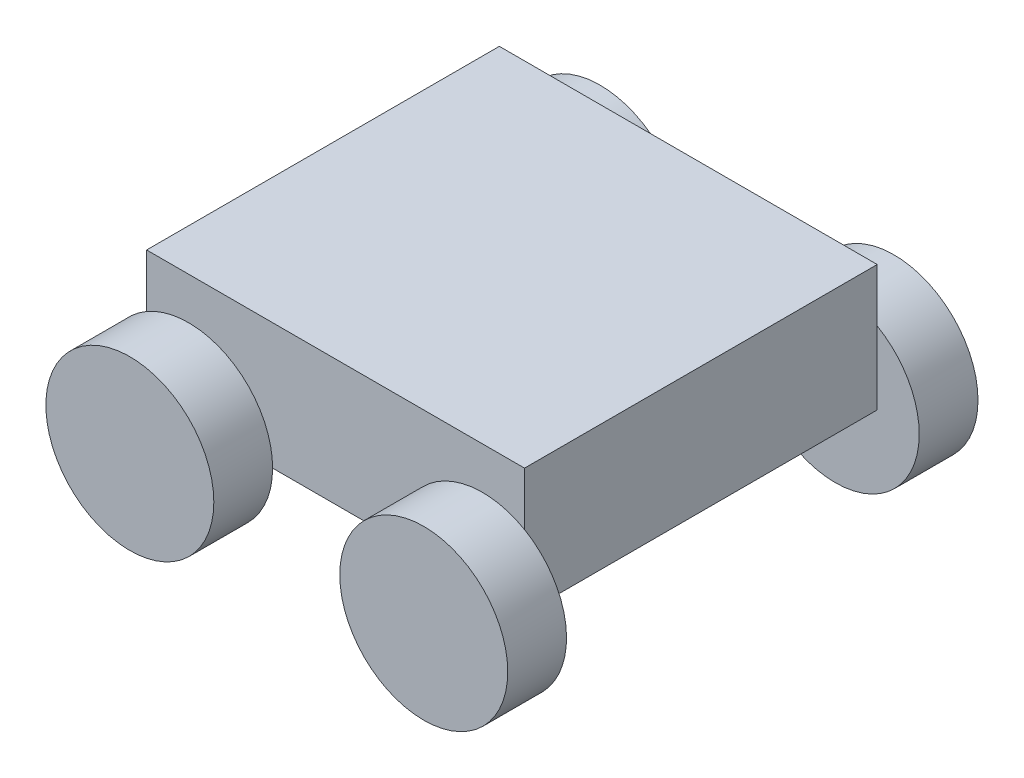
from build123d import *

# Parameters (mm, degrees)
SKETCH2_W           = 450
SKETCH2_H           = 420
BOSS_EXTRUDE1_DEPTH = 150
SKETCH3_R           = 100
BOSS_EXTRUDE2_DEPTH = 70


with BuildPart() as part:
    # Sketch2 → Boss-Extrude1 (new body)
    with BuildSketch(Plane(origin=(0, 0, 0), x_dir=(1, 0, 0), z_dir=(0, 1, 0))):
        Rectangle(SKETCH2_W, SKETCH2_H)
    extrude(amount=BOSS_EXTRUDE1_DEPTH)

    # Sketch3 → Boss-Extrude2 (add)
    with BuildSketch(Plane.XY.offset(210)):
        with Locations((-175, 0)):
            Circle(SKETCH3_R)
        with Locations(Location((175, 0, 0), (0, 0, 180))):
            Circle(SKETCH3_R)
    boss_extrude2 = extrude(amount=BOSS_EXTRUDE2_DEPTH)

    # Mirror1: Boss-Extrude2 across plane
    add(boss_extrude2.mirror(Plane.XY))


solid = part.part
